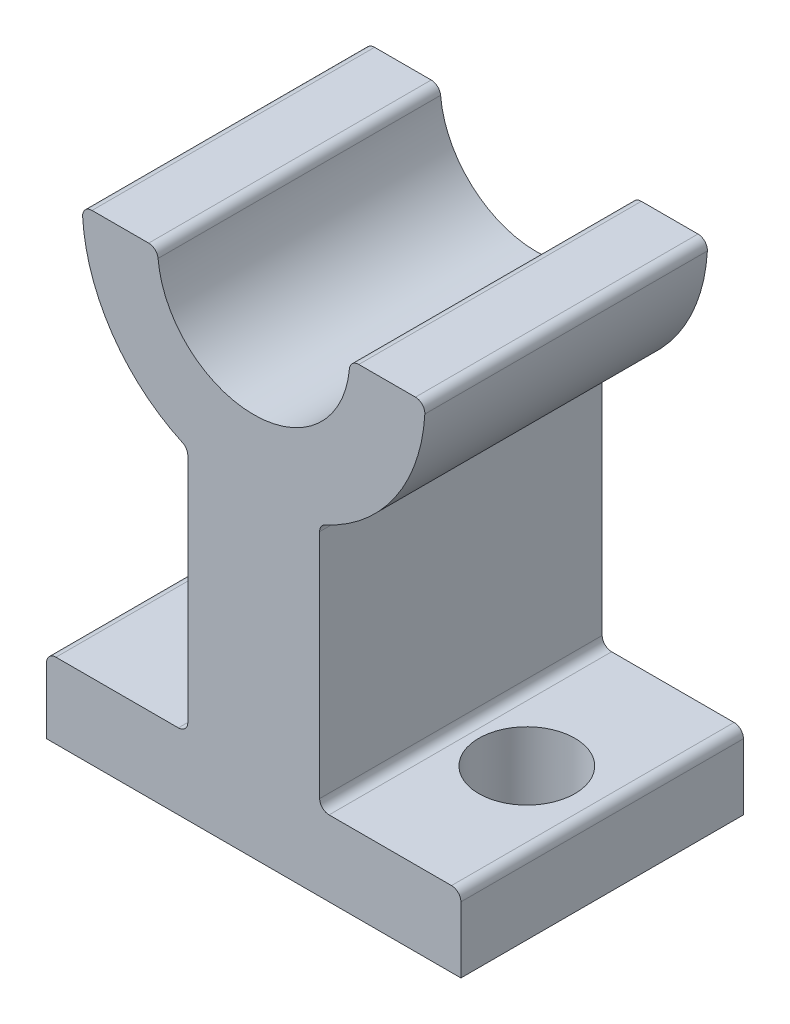
from build123d import *

# Parameters (mm, degrees)
SALIENTE_EXTRUIR1_DEPTH = 15
REDONDEO1_R             = 0.5
REDONDEO2_R             = 0.5
CROQUIS3_R              = 2.55
CORTAR_EXTRUIR1_DEPTH   = 6


with BuildPart() as part:
    # Croquis1 → Saliente-Extruir1 (new body)
    with BuildSketch(Plane.XY):
        with BuildLine():
            Line((-11, 2), (-3.5, 2))
            Line((-3.5, 2), (-3.5, 15.1))
            ThreePointArc((-3.5, 15.1), (-7.571657678, 18.452228214), (-9.1, 23.5))
            Line((-9.1, 23.5), (-5.1, 23.5))
            ThreePointArc((-5.1, 23.5), (0, 18.4), (5.1, 23.5))
            Line((5.1, 23.5), (9.1, 23.5))
            ThreePointArc((9.1, 23.5), (7.571657678, 18.452228214), (3.5, 15.1))
            Line((3.5, 15.1), (3.5, 2))
            Line((3.5, 2), (11, 2))
            Line((11, 2), (11, -2))
            Line((11, -2), (-11, -2))
            Line((-11, -2), (-11, 2))
        make_face()
    extrude(amount=SALIENTE_EXTRUIR1_DEPTH)

    # Redondeo1
    redondeo1_edges = [part.edges().sort_by_distance(p)[0] for p in [
        (-3.5, 2, 7.5),
        (-3.5, 15.1, 7.5),
        (3.5, 15.1, 7.5),
        (3.5, 2, 7.5),
    ]]
    fillet(redondeo1_edges, radius=REDONDEO1_R)

    # Redondeo2
    redondeo2_edges = [part.edges().sort_by_distance(p)[0] for p in [
        (-11, 2, 7.5),
        (-9.1, 23.5, 7.5),
        (-5.1, 23.5, 7.5),
        (5.1, 23.5, 7.5),
        (9.1, 23.5, 7.5),
        (11, 2, 7.5),
    ]]
    fillet(redondeo2_edges, radius=REDONDEO2_R)

    # Croquis3 → Cortar-Extruir1 (cut)
    with BuildSketch(Plane.XZ.offset(2)):
        with Locations(Location((-7, 7.5, 0), (0, 0, 270))):
            Circle(CROQUIS3_R)
        with Locations((7, 7.5)):
            Circle(CROQUIS3_R)
    extrude(amount=-CORTAR_EXTRUIR1_DEPTH, mode=Mode.SUBTRACT)


solid = part.part
